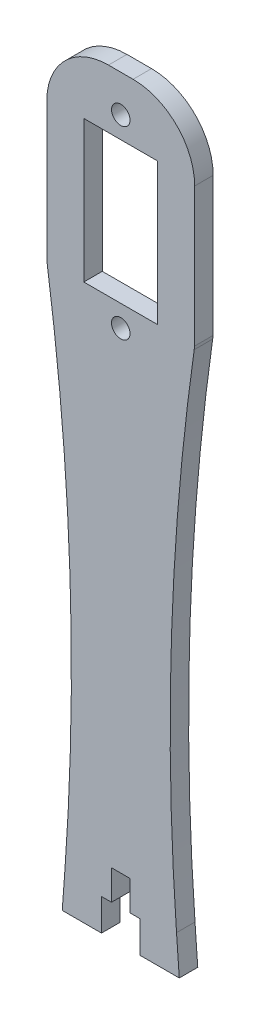
from build123d import *

# Parameters (mm, degrees)
ESBO_O1_R                = 1.5
RESSALTO_EXTRUS_O1_DEPTH = 3


with BuildPart() as part:
    # Esboço1 → Ressalto-extrusão1 (new body)
    with BuildSketch(Plane.XY):
        with BuildLine():
            Line((3.125, -119.95), (3.125, -125.1))
            Line((3.125, -125.1), (9.5, -125.1))
            Line((9.5, -125.1), (9.051444859, -118.948386637))
            ThreePointArc((9.051444859, -118.948386637), (8.249352939, -77.177382145), (11.920153881, -35.560253603))
            Line((11.920153881, -35.560253603), (12, -35))
            Line((12, -35), (12, -12.5))
            ThreePointArc((12, -12.5), (9.071067812, -5.428932188), (2, -2.5))
            Line((2, -2.5), (0, -2.5))
            Line((0, -2.5), (-2, -2.5))
            ThreePointArc((-2, -2.5), (-9.071067812, -5.428932188), (-12, -12.5))
            Line((-12, -12.5), (-12, -35))
            Line((-12, -35), (-11.920153926, -35.560253285))
            ThreePointArc((-11.920153926, -35.560253285), (-8.249352944, -77.177381984), (-9.051444859, -118.948386634))
            Line((-9.051444859, -118.948386634), (-9.5, -125.1))
            Line((-9.5, -125.1), (-3.125, -125.1))
            Line((-3.125, -125.1), (-3.125, -119.95))
            Line((-3.125, -119.95), (-1.5, -119.95))
            Line((-1.5, -119.95), (-1.5, -115.1))
            Line((-1.5, -115.1), (1.5, -115.1))
            Line((1.5, -115.1), (1.5, -119.95))
            Line((1.5, -119.95), (3.125, -119.95))
        make_face()
        with Locations(Location((0, -8.5, 0), (0, 0, 180))):
            Circle(ESBO_O1_R, mode=Mode.SUBTRACT)
        with Locations(Location((0, -38.499871023, 0), (0, 0, 180))):
            Circle(ESBO_O1_R, mode=Mode.SUBTRACT)
        Polygon((-6, -23.5), (-6, -12), (6, -12), (6, -35), (2.474745195, -35), (-2.5, -35), (-6, -35), align=None, mode=Mode.SUBTRACT)
    extrude(amount=RESSALTO_EXTRUS_O1_DEPTH)


solid = part.part
